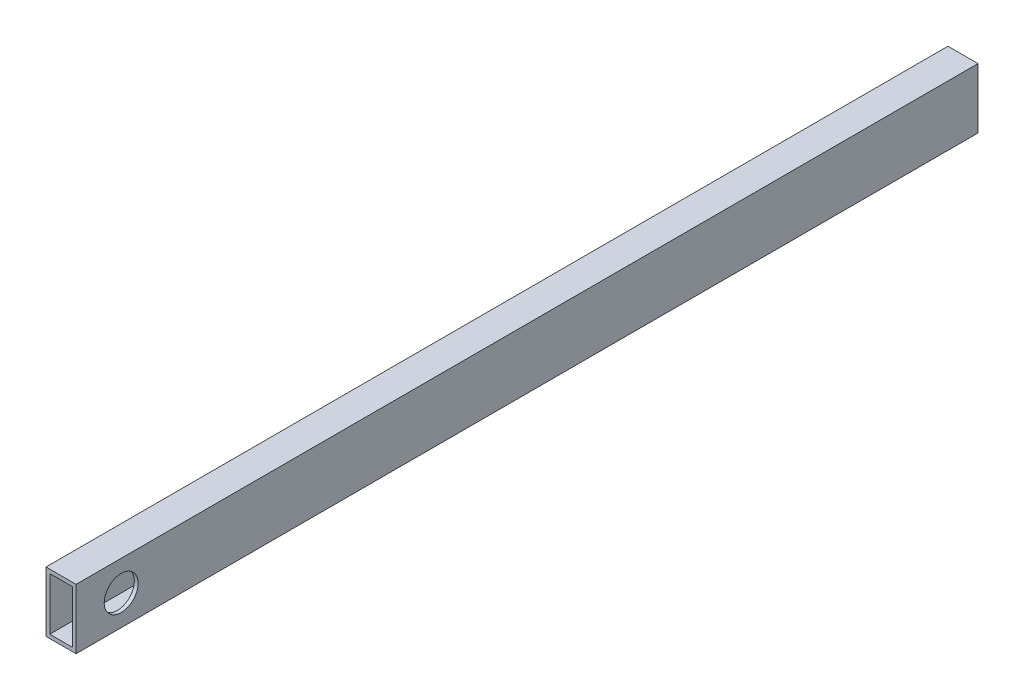
from build123d import *

# Parameters (mm, degrees)
SKETCH1_W           = 25.4
SKETCH1_H           = 50.8
SKETCH1_W_2         = 19.05
SKETCH1_H_2         = 44.45
BOSS_EXTRUDE1_DEPTH = 762
SKETCH2_R           = 14.3129
CUT_EXTRUDE1_DEPTH  = 763.846196818


with BuildPart() as part:
    # Sketch1 → Boss-Extrude1 (new body)
    with BuildSketch(Plane.XY):
        Rectangle(SKETCH1_W, SKETCH1_H)
        Rectangle(SKETCH1_W_2, SKETCH1_H_2, mode=Mode.SUBTRACT)
    extrude(amount=BOSS_EXTRUDE1_DEPTH)

    # Sketch2 → Cut-Extrude1 (cut, through all)
    with BuildSketch(Plane.ZY.offset(12.7)):
        with Locations((723.9, 0)):
            Circle(SKETCH2_R)
    extrude(amount=-CUT_EXTRUDE1_DEPTH, mode=Mode.SUBTRACT)


solid = part.part
